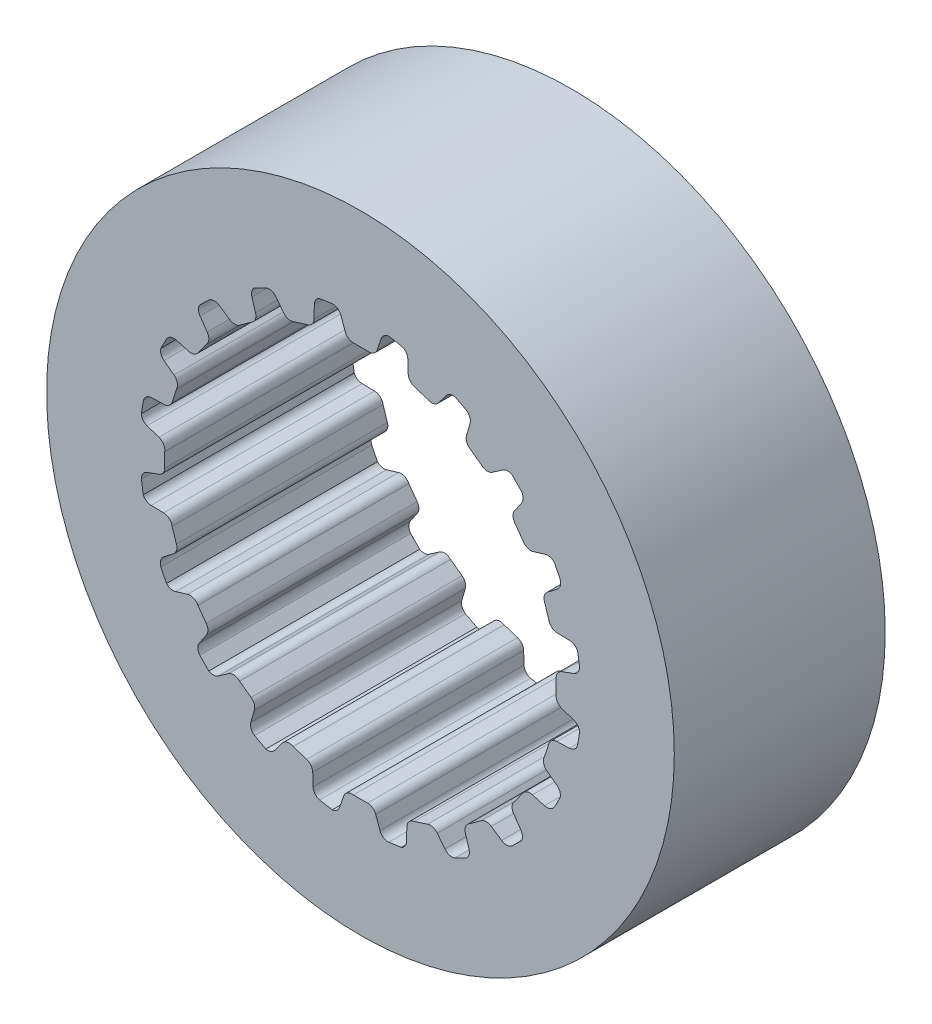
from build123d import *

# Parameters (mm, degrees)
SKETCH1_R           = 4.7625
BOSS_EXTRUDE1_DEPTH = 1.6002


with BuildPart() as part:
    # Sketch1 → Boss-Extrude1 (new, symmetric)
    with BuildSketch(Plane.XY):
        Circle(SKETCH1_R)
        with BuildLine():
            Line((-0.106949245, 2.969874934), (0.106949245, 2.969874934))
            ThreePointArc((0.106949245, 2.969874934), (0.196343213, 2.986924176), (0.253739238, 3.057547504))
            Line((0.253739238, 3.057547504), (0.315888147, 3.237526941))
            ThreePointArc((0.315888147, 3.237526941), (0.359032156, 3.298322911), (0.4281449, 3.326269005))
            Line((0.4281449, 3.326269005), (0.620027588, 3.2937547))
            ThreePointArc((0.620027588, 3.2937547), (0.689621142, 3.24802576), (0.718272212, 3.169836791))
            Line((0.718272212, 3.169836791), (0.724389167, 2.979527391))
            ThreePointArc((0.724389167, 2.979527391), (0.750934762, 2.9040661), (0.816027049, 2.857568043))
            Line((0.816027049, 2.857568043), (1.019456602, 2.791469774))
            ThreePointArc((1.019456602, 2.791469774), (1.109743823, 2.780060312), (1.186154496, 2.829490741))
            Line((1.186154496, 2.829490741), (1.300878326, 2.981456288))
            ThreePointArc((1.300878326, 2.981456288), (1.360697704, 3.02594446), (1.435063648, 3.031165762))
            Line((1.435063648, 3.031165762), (1.607507455, 2.940947809))
            ThreePointArc((1.607507455, 2.940947809), (1.659563839, 2.875951412), (1.662650905, 2.792735615))
            Line((1.662650905, 2.792735615), (1.609659636, 2.609850378))
            ThreePointArc((1.609659636, 2.609850378), (1.611587176, 2.529879385), (1.659124931, 2.465542482))
            Line((1.659124931, 2.465542482), (1.832172444, 2.339816104))
            ThreePointArc((1.832172444, 2.339816104), (1.914514976, 2.301064775), (2.002460687, 2.32446371))
            Line((2.002460687, 2.32446371), (2.158529469, 2.433539921))
            ThreePointArc((2.158529469, 2.433539921), (2.229168681, 2.457365482), (2.301508367, 2.439350895))
            Line((2.301508367, 2.439350895), (2.437633293, 2.300260456))
            ThreePointArc((2.437633293, 2.300260456), (2.467056864, 2.222358901), (2.444277744, 2.14226202))
            Line((2.444277744, 2.14226202), (2.337365406, 1.984703026))
            ThreePointArc((2.337365406, 1.984703026), (2.314486209, 1.908050449), (2.339816104, 1.832172444))
            Line((2.339816104, 1.832172444), (2.465542482, 1.659124931))
            ThreePointArc((2.465542482, 1.659124931), (2.531880064, 1.596824985), (2.622752074, 1.591901975))
            Line((2.622752074, 1.591901975), (2.804888709, 1.64741171))
            ThreePointArc((2.804888709, 1.64741171), (2.879433095, 1.648242449), (2.942665411, 1.608755366))
            Line((2.942665411, 1.608755366), (3.0291466, 1.434407582))
            ThreePointArc((3.0291466, 1.434407582), (3.033057175, 1.351226417), (2.986641646, 1.282088892))
            Line((2.986641646, 1.282088892), (2.836273564, 1.165279113))
            ThreePointArc((2.836273564, 1.165279113), (2.790827206, 1.099448241), (2.791469774, 1.019456602))
            Line((2.791469774, 1.019456602), (2.857568043, 0.816027049))
            ThreePointArc((2.857568043, 0.816027049), (2.901407091, 0.736276839), (2.986310214, 0.703513784))
            Line((2.986310214, 0.703513784), (3.1766859, 0.700023363))
            ThreePointArc((3.1766859, 0.700023363), (3.247838536, 0.677777961), (3.295773863, 0.620683653))
            Line((3.295773863, 0.620683653), (3.324145932, 0.4281449))
            ThreePointArc((3.324145932, 0.4281449), (3.302160717, 0.347826477), (3.236652255, 0.29641597))
            Line((3.236652255, 0.29641597), (3.057547504, 0.231789562))
            ThreePointArc((3.057547504, 0.231789562), (2.993982591, 0.183224379), (2.969874934, 0.106949245))
            Line((2.969874934, 0.106949245), (2.969874934, -0.106949245))
            ThreePointArc((2.969874934, -0.106949245), (2.986924176, -0.196343213), (3.057547504, -0.253739238))
            Line((3.057547504, -0.253739238), (3.237526941, -0.315888147))
            ThreePointArc((3.237526941, -0.315888147), (3.298322911, -0.359032156), (3.326269005, -0.4281449))
            Line((3.326269005, -0.4281449), (3.2937547, -0.620027588))
            ThreePointArc((3.2937547, -0.620027588), (3.24802576, -0.689621142), (3.169836791, -0.718272212))
            Line((3.169836791, -0.718272212), (2.979527391, -0.724389167))
            ThreePointArc((2.979527391, -0.724389167), (2.9040661, -0.750934762), (2.857568043, -0.816027049))
            Line((2.857568043, -0.816027049), (2.791469774, -1.019456602))
            ThreePointArc((2.791469774, -1.019456602), (2.780060312, -1.109743823), (2.829490741, -1.186154496))
            Line((2.829490741, -1.186154496), (2.981456288, -1.300878326))
            ThreePointArc((2.981456288, -1.300878326), (3.02594446, -1.360697704), (3.031165762, -1.435063648))
            Line((3.031165762, -1.435063648), (2.940947809, -1.607507455))
            ThreePointArc((2.940947809, -1.607507455), (2.875951412, -1.659563839), (2.792735615, -1.662650905))
            Line((2.792735615, -1.662650905), (2.609850378, -1.609659636))
            ThreePointArc((2.609850378, -1.609659636), (2.529879385, -1.611587176), (2.465542482, -1.659124931))
            Line((2.465542482, -1.659124931), (2.339816104, -1.832172444))
            ThreePointArc((2.339816104, -1.832172444), (2.301064775, -1.914514976), (2.32446371, -2.002460687))
            Line((2.32446371, -2.002460687), (2.433539921, -2.158529469))
            ThreePointArc((2.433539921, -2.158529469), (2.457365482, -2.229168681), (2.439350895, -2.301508367))
            Line((2.439350895, -2.301508367), (2.300260456, -2.437633293))
            ThreePointArc((2.300260456, -2.437633293), (2.222358901, -2.467056864), (2.14226202, -2.444277744))
            Line((2.14226202, -2.444277744), (1.984703026, -2.337365406))
            ThreePointArc((1.984703026, -2.337365406), (1.908050449, -2.314486209), (1.832172444, -2.339816104))
            Line((1.832172444, -2.339816104), (1.659124931, -2.465542482))
            ThreePointArc((1.659124931, -2.465542482), (1.596824985, -2.531880064), (1.591901975, -2.622752074))
            Line((1.591901975, -2.622752074), (1.64741171, -2.804888709))
            ThreePointArc((1.64741171, -2.804888709), (1.648242449, -2.879433095), (1.608755366, -2.942665411))
            Line((1.608755366, -2.942665411), (1.434407582, -3.0291466))
            ThreePointArc((1.434407582, -3.0291466), (1.351226417, -3.033057175), (1.282088892, -2.986641646))
            Line((1.282088892, -2.986641646), (1.165279113, -2.836273564))
            ThreePointArc((1.165279113, -2.836273564), (1.099448241, -2.790827206), (1.019456602, -2.791469774))
            Line((1.019456602, -2.791469774), (0.816027049, -2.857568043))
            ThreePointArc((0.816027049, -2.857568043), (0.736276839, -2.901407091), (0.703513784, -2.986310214))
            Line((0.703513784, -2.986310214), (0.700023363, -3.1766859))
            ThreePointArc((0.700023363, -3.1766859), (0.677777961, -3.247838536), (0.620683653, -3.295773863))
            Line((0.620683653, -3.295773863), (0.4281449, -3.324145932))
            ThreePointArc((0.4281449, -3.324145932), (0.347826477, -3.302160717), (0.29641597, -3.236652255))
            Line((0.29641597, -3.236652255), (0.231789562, -3.057547504))
            ThreePointArc((0.231789562, -3.057547504), (0.183224379, -2.993982591), (0.106949245, -2.969874934))
            Line((0.106949245, -2.969874934), (-0.106949245, -2.969874934))
            ThreePointArc((-0.106949245, -2.969874934), (-0.196343213, -2.986924176), (-0.253739238, -3.057547504))
            Line((-0.253739238, -3.057547504), (-0.315888147, -3.237526941))
            ThreePointArc((-0.315888147, -3.237526941), (-0.359032156, -3.298322911), (-0.4281449, -3.326269005))
            Line((-0.4281449, -3.326269005), (-0.620027588, -3.2937547))
            ThreePointArc((-0.620027588, -3.2937547), (-0.689621142, -3.24802576), (-0.718272212, -3.169836791))
            Line((-0.718272212, -3.169836791), (-0.724389167, -2.979527391))
            ThreePointArc((-0.724389167, -2.979527391), (-0.750934762, -2.9040661), (-0.816027049, -2.857568043))
            Line((-0.816027049, -2.857568043), (-1.019456602, -2.791469774))
            ThreePointArc((-1.019456602, -2.791469774), (-1.109743823, -2.780060312), (-1.186154496, -2.829490741))
            Line((-1.186154496, -2.829490741), (-1.300878326, -2.981456288))
            ThreePointArc((-1.300878326, -2.981456288), (-1.360697704, -3.02594446), (-1.435063648, -3.031165762))
            Line((-1.435063648, -3.031165762), (-1.607507455, -2.940947809))
            ThreePointArc((-1.607507455, -2.940947809), (-1.659563839, -2.875951412), (-1.662650905, -2.792735615))
            Line((-1.662650905, -2.792735615), (-1.609659636, -2.609850378))
            ThreePointArc((-1.609659636, -2.609850378), (-1.611587176, -2.529879385), (-1.659124931, -2.465542482))
            Line((-1.659124931, -2.465542482), (-1.832172444, -2.339816104))
            ThreePointArc((-1.832172444, -2.339816104), (-1.914514976, -2.301064775), (-2.002460687, -2.32446371))
            Line((-2.002460687, -2.32446371), (-2.158529469, -2.433539921))
            ThreePointArc((-2.158529469, -2.433539921), (-2.229168681, -2.457365482), (-2.301508367, -2.439350895))
            Line((-2.301508367, -2.439350895), (-2.437633293, -2.300260456))
            ThreePointArc((-2.437633293, -2.300260456), (-2.467056864, -2.222358901), (-2.444277744, -2.14226202))
            Line((-2.444277744, -2.14226202), (-2.337365406, -1.984703026))
            ThreePointArc((-2.337365406, -1.984703026), (-2.314486209, -1.908050449), (-2.339816104, -1.832172444))
            Line((-2.339816104, -1.832172444), (-2.465542482, -1.659124931))
            ThreePointArc((-2.465542482, -1.659124931), (-2.531880064, -1.596824985), (-2.622752074, -1.591901975))
            Line((-2.622752074, -1.591901975), (-2.804888709, -1.64741171))
            ThreePointArc((-2.804888709, -1.64741171), (-2.879433095, -1.648242449), (-2.942665411, -1.608755366))
            Line((-2.942665411, -1.608755366), (-3.0291466, -1.434407582))
            ThreePointArc((-3.0291466, -1.434407582), (-3.033057175, -1.351226417), (-2.986641646, -1.282088892))
            Line((-2.986641646, -1.282088892), (-2.836273564, -1.165279113))
            ThreePointArc((-2.836273564, -1.165279113), (-2.790827206, -1.099448241), (-2.791469774, -1.019456602))
            Line((-2.791469774, -1.019456602), (-2.857568043, -0.816027049))
            ThreePointArc((-2.857568043, -0.816027049), (-2.901407091, -0.736276839), (-2.986310214, -0.703513784))
            Line((-2.986310214, -0.703513784), (-3.1766859, -0.700023363))
            ThreePointArc((-3.1766859, -0.700023363), (-3.247838536, -0.677777961), (-3.295773863, -0.620683653))
            Line((-3.295773863, -0.620683653), (-3.324145932, -0.4281449))
            ThreePointArc((-3.324145932, -0.4281449), (-3.302160717, -0.347826477), (-3.236652255, -0.29641597))
            Line((-3.236652255, -0.29641597), (-3.057547504, -0.231789562))
            ThreePointArc((-3.057547504, -0.231789562), (-2.993982591, -0.183224379), (-2.969874934, -0.106949245))
            Line((-2.969874934, -0.106949245), (-2.969874934, 0.106949245))
            ThreePointArc((-2.969874934, 0.106949245), (-2.986924176, 0.196343213), (-3.057547504, 0.253739238))
            Line((-3.057547504, 0.253739238), (-3.237526941, 0.315888147))
            ThreePointArc((-3.237526941, 0.315888147), (-3.298322911, 0.359032156), (-3.326269005, 0.4281449))
            Line((-3.326269005, 0.4281449), (-3.2937547, 0.620027588))
            ThreePointArc((-3.2937547, 0.620027588), (-3.24802576, 0.689621142), (-3.169836791, 0.718272212))
            Line((-3.169836791, 0.718272212), (-2.979527391, 0.724389167))
            ThreePointArc((-2.979527391, 0.724389167), (-2.9040661, 0.750934762), (-2.857568043, 0.816027049))
            Line((-2.857568043, 0.816027049), (-2.791469774, 1.019456602))
            ThreePointArc((-2.791469774, 1.019456602), (-2.780060312, 1.109743823), (-2.829490741, 1.186154496))
            Line((-2.829490741, 1.186154496), (-2.981456288, 1.300878326))
            ThreePointArc((-2.981456288, 1.300878326), (-3.02594446, 1.360697704), (-3.031165762, 1.435063648))
            Line((-3.031165762, 1.435063648), (-2.940947809, 1.607507455))
            ThreePointArc((-2.940947809, 1.607507455), (-2.875951412, 1.659563839), (-2.792735615, 1.662650905))
            Line((-2.792735615, 1.662650905), (-2.609850378, 1.609659636))
            ThreePointArc((-2.609850378, 1.609659636), (-2.529879385, 1.611587176), (-2.465542482, 1.659124931))
            Line((-2.465542482, 1.659124931), (-2.339816104, 1.832172444))
            ThreePointArc((-2.339816104, 1.832172444), (-2.301064775, 1.914514976), (-2.32446371, 2.002460687))
            Line((-2.32446371, 2.002460687), (-2.433539921, 2.158529469))
            ThreePointArc((-2.433539921, 2.158529469), (-2.457365482, 2.229168681), (-2.439350895, 2.301508367))
            Line((-2.439350895, 2.301508367), (-2.300260456, 2.437633293))
            ThreePointArc((-2.300260456, 2.437633293), (-2.222358901, 2.467056864), (-2.14226202, 2.444277744))
            Line((-2.14226202, 2.444277744), (-1.984703026, 2.337365406))
            ThreePointArc((-1.984703026, 2.337365406), (-1.908050449, 2.314486209), (-1.832172444, 2.339816104))
            Line((-1.832172444, 2.339816104), (-1.659124931, 2.465542482))
            ThreePointArc((-1.659124931, 2.465542482), (-1.596824985, 2.531880064), (-1.591901975, 2.622752074))
            Line((-1.591901975, 2.622752074), (-1.64741171, 2.804888709))
            ThreePointArc((-1.64741171, 2.804888709), (-1.648242449, 2.879433095), (-1.608755366, 2.942665411))
            Line((-1.608755366, 2.942665411), (-1.434407582, 3.0291466))
            ThreePointArc((-1.434407582, 3.0291466), (-1.351226417, 3.033057175), (-1.282088892, 2.986641646))
            Line((-1.282088892, 2.986641646), (-1.165279113, 2.836273564))
            ThreePointArc((-1.165279113, 2.836273564), (-1.099448241, 2.790827206), (-1.019456602, 2.791469774))
            Line((-1.019456602, 2.791469774), (-0.816027049, 2.857568043))
            ThreePointArc((-0.816027049, 2.857568043), (-0.736276839, 2.901407091), (-0.703513784, 2.986310214))
            Line((-0.703513784, 2.986310214), (-0.700023363, 3.1766859))
            ThreePointArc((-0.700023363, 3.1766859), (-0.677777961, 3.247838536), (-0.620683653, 3.295773863))
            Line((-0.620683653, 3.295773863), (-0.4281449, 3.324145932))
            ThreePointArc((-0.4281449, 3.324145932), (-0.347826477, 3.302160717), (-0.29641597, 3.236652255))
            Line((-0.29641597, 3.236652255), (-0.231789562, 3.057547504))
            ThreePointArc((-0.231789562, 3.057547504), (-0.183224379, 2.993982591), (-0.106949245, 2.969874934))
        make_face(mode=Mode.SUBTRACT)
    extrude(amount=BOSS_EXTRUDE1_DEPTH, both=True)


solid = part.part
